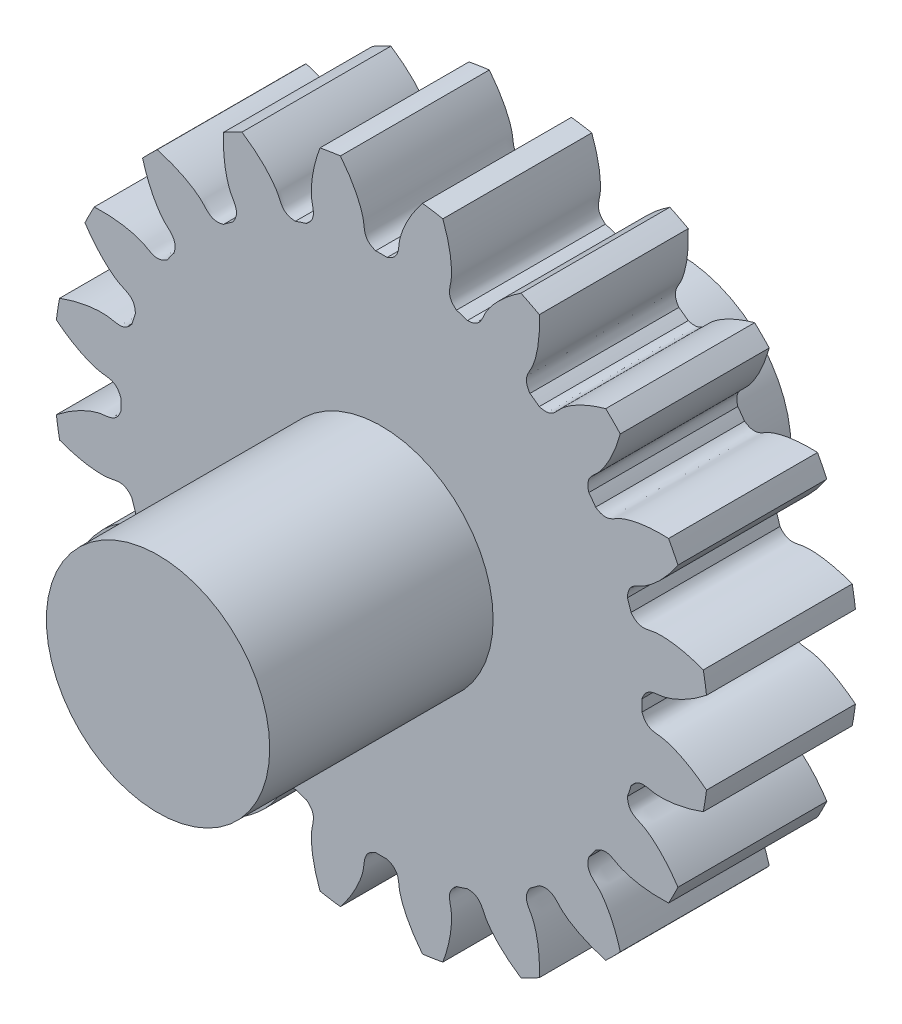
from build123d import *

# Parameters (mm, degrees)
SKETCH_1_R               = 22
EXTRUDE_1_DEPTH          = 10
CUT_EXTRUDE_1_DEPTH      = 33.680269277
PATTERN_CIRCULAR_1_COUNT = 20
SKETCH_4_R               = 7.5
EXTRUDE_2_DEPTH          = 15
EXTRUDE_START            = 10
SKETCH_6_R               = 7.5
EXTRUDE_3_DEPTH          = 10


with BuildPart() as part:
    # 草图1 → 凸台-拉伸1 (new body)
    with BuildSketch(Plane.XY):
        Circle(SKETCH_1_R)
    extrude(amount=EXTRUDE_1_DEPTH)

    # 草图2 → 切除-拉伸1 (cut, through all)
    with BuildSketch(Plane.XY):
        with BuildLine():
            ThreePointArc((0.386633201, 17.495728472), (0, 17.5), (-0.386633201, 17.495728472))
            add(Edge.make_bspline(
                [(-0.386633201, 17.495728472), (-1.22237881, 17.786951024), (-1.114168199, 18.374227398), (-1.225794113, 18.940018805), (-1.237784373, 18.995113228), (-1.25262178, 19.05726923), (-1.270584194, 19.126393672), (-1.29195828, 19.202382994), (-1.31702411, 19.285125656), (-1.346059743, 19.374501466), (-1.3793395, 19.470381894), (-1.4171342, 19.57263009), (-1.459710797, 19.681101001), (-1.507332204, 19.795641461), (-1.560257063, 19.916090303), (-1.618739529, 20.042278463), (-1.683029067, 20.174029102), (-1.753370234, 20.311157723), (-1.830002477, 20.4534723), (-1.913159931, 20.600773408), (-2.003071219, 20.752854362), (-2.099959252, 20.909501356), (-2.204041043, 21.070493611), (-2.315527511, 21.235603527), (-2.434623302, 21.404596841), (-2.561526601, 21.577232781), (-2.696428961, 21.753264241), (-2.839515123, 21.932437945), (-2.990962853, 22.114494623), (-3.15094277, 22.299169189), (-3.319618193, 22.486190926), (-3.497144978, 22.67528367), (-3.683671369, 22.866166005), (-3.879337852, 23.058551454), (-4.084277013, 23.252148679), (-4.298613397, 23.446661685), (-4.522463379, 23.641790022), (-4.755935037, 23.837228999), (-4.999128023, 24.032669892), (-5.252133469, 24.227800163), (-5.515033799, 24.42230368), (-5.882947182, 24.683279735), (-6.167864825, 24.872665202), (-6.362315964, 24.996503719)],
                knots=[0, 0, 0, 0, 0.165916003, 0.170905922, 0.176663519, 0.183188797, 0.190481754, 0.198542391, 0.207370708, 0.216966704, 0.22733038, 0.238461736, 0.250360771, 0.263027487, 0.276461881, 0.290663956, 0.30563371, 0.321371144, 0.337876258, 0.355149051, 0.373189524, 0.391997677, 0.411573509, 0.431917021, 0.453028213, 0.474907084, 0.497553636, 0.520967867, 0.545149777, 0.570099367, 0.595816637, 0.622301587, 0.649554216, 0.677574526, 0.706362514, 0.735918183, 0.766241531, 0.797332559, 0.829191267, 0.861817654, 0.895211721, 0.929373468, 1, 1, 1, 1], degree=3))
            ThreePointArc((-6.362315964, 24.996503719), (0, 25.793492641), (6.362315964, 24.996503719))
            add(Edge.make_bspline(
                [(0.386633201, 17.495728472), (1.22237881, 17.786951024), (1.114168199, 18.374227398), (1.225794113, 18.940018805), (1.237784373, 18.995113228), (1.25262178, 19.05726923), (1.270584194, 19.126393672), (1.29195828, 19.202382994), (1.31702411, 19.285125656), (1.346059743, 19.374501466), (1.3793395, 19.470381894), (1.4171342, 19.57263009), (1.459710797, 19.681101001), (1.507332204, 19.795641461), (1.560257063, 19.916090303), (1.618739529, 20.042278463), (1.683029067, 20.174029102), (1.753370234, 20.311157723), (1.830002477, 20.4534723), (1.913159931, 20.600773408), (2.003071219, 20.752854362), (2.099959252, 20.909501356), (2.204041043, 21.070493611), (2.315527511, 21.235603527), (2.434623302, 21.404596841), (2.561526601, 21.577232781), (2.696428961, 21.753264241), (2.839515123, 21.932437945), (2.990962853, 22.114494623), (3.15094277, 22.299169189), (3.319618193, 22.486190926), (3.497144978, 22.67528367), (3.683671369, 22.866166005), (3.879337852, 23.058551454), (4.084277013, 23.252148679), (4.298613397, 23.446661685), (4.522463379, 23.641790022), (4.755935037, 23.837228999), (4.999128023, 24.032669892), (5.252133469, 24.227800163), (5.515033799, 24.42230368), (5.882947182, 24.683279735), (6.167864825, 24.872665202), (6.362315964, 24.996503719)],
                knots=[0, 0, 0, 0, 0.165916003, 0.170905922, 0.176663519, 0.183188797, 0.190481754, 0.198542391, 0.207370708, 0.216966704, 0.22733038, 0.238461736, 0.250360771, 0.263027487, 0.276461881, 0.290663956, 0.30563371, 0.321371144, 0.337876258, 0.355149051, 0.373189524, 0.391997677, 0.411573509, 0.431917021, 0.453028213, 0.474907084, 0.497553636, 0.520967867, 0.545149777, 0.570099367, 0.595816637, 0.622301587, 0.649554216, 0.677574526, 0.706362514, 0.735918183, 0.766241531, 0.797332559, 0.829191267, 0.861817654, 0.895211721, 0.929373468, 1, 1, 1, 1], degree=3))
        make_face()
    cut_extrude_1 = extrude(amount=CUT_EXTRUDE_1_DEPTH, mode=Mode.SUBTRACT)

    # 阵列(圆周)1: 切除-拉伸1 ×20 about axis
    pattern_circular_1_axis = Axis((0, 0, 10), (0, 0, -1))
    for i in range(1, PATTERN_CIRCULAR_1_COUNT):
        add(cut_extrude_1.rotate(pattern_circular_1_axis, i * 360 / PATTERN_CIRCULAR_1_COUNT), mode=Mode.SUBTRACT)

    # 草图4 → 凸台-拉伸2 (add)
    with BuildSketch(Plane.XY.offset(10)):
        Circle(SKETCH_4_R)
    extrude(amount=EXTRUDE_2_DEPTH)

    # 草图6 → 凸台-拉伸3 (add)
    with BuildSketch(Plane(origin=(0, 0, 0), x_dir=(-1, 0, 0), z_dir=(0, 0, -1)).offset(EXTRUDE_START)):
        Circle(SKETCH_6_R)
    extrude(amount=-EXTRUDE_3_DEPTH)


solid = part.part
